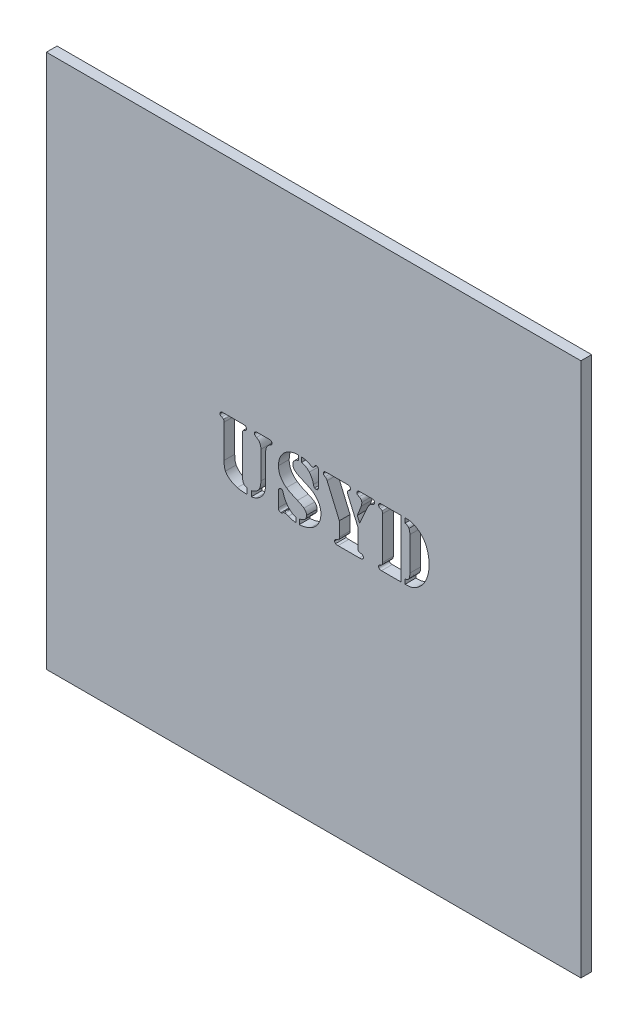
from build123d import *

# Parameters (mm, degrees)
SKETCH_2_W          = 100
SKETCH_2_H          = 100
EXTRUDE_2_DEPTH     = 2
CUT_EXTRUDE_1_DEPTH = 2


with BuildPart() as part:
    # 草图2 → 凸台-拉伸2 (new body)
    with BuildSketch(Plane.XY):
        with Locations((50, -50)):
            Rectangle(SKETCH_2_W, SKETCH_2_H)
    extrude(amount=EXTRUDE_2_DEPTH)

    # 草图5 → 切除-拉伸1 (cut)
    with BuildSketch(Plane.XY.offset(2)):
        with BuildLine():
            Line((33.234252528, -49.527946726), (33.234252528, -43.336225313))
            add(Edge.make_bspline(
                [(33.234252528, -43.336225313), (33.233680733, -43.292457438), (33.23261396, -43.21080157), (33.216775517, -43.098302202), (33.189981346, -43.00317877), (33.159591489, -42.951072897), (33.145297741, -42.926565106)],
                knots=[0, 0, 0, 0, 1.234380862, 2.302932019, 3.201790819, 4, 4, 4, 4], degree=3))
            add(Edge.make_bspline(
                [(33.145297741, -42.926565106), (33.132472916, -42.906095532), (33.11015473, -42.870473698), (33.067254502, -42.83595353), (33.019592543, -42.818169631), (32.962413365, -42.794281107), (32.878493497, -42.764053581), (32.814438943, -42.740862121), (32.777774012, -42.727587291)],
                knots=[0, 0, 0, 0, 1.009569614, 1.75688657, 2.256055053, 3.138468602, 4.362054748, 6, 6, 6, 6], degree=3))
            add(Edge.make_bspline(
                [(32.777774012, -42.727587291), (32.733041285, -42.70864447), (32.647816788, -42.67255473), (32.551225196, -42.572597106), (32.494199785, -42.444987847), (32.488297489, -42.351332059), (32.485159579, -42.301540676)],
                knots=[0, 0, 0, 0, 1.041483567, 1.98422766, 2.928330066, 4, 4, 4, 4], degree=3))
            add(Edge.make_bspline(
                [(32.485159579, -42.301540676), (32.486918159, -42.26858758), (32.49024579, -42.206232873), (32.516392092, -42.118297668), (32.562394983, -42.043374992), (32.626983719, -41.981481726), (32.708896069, -41.935524926), (32.803900692, -41.898792747), (32.915342853, -41.882296462), (32.99389192, -41.879374423), (33.035274714, -41.877834976)],
                knots=[0, 0, 0, 0, 1.002726072, 1.897384446, 2.761532256, 3.652394326, 4.589906903, 5.605228772, 6.738338646, 8, 8, 8, 8], degree=3))
            Line((33.035274714, -41.877834976), (33.227229782, -41.877834976))
            Line((33.227229782, -41.877834976), (36.687102844, -41.877834976))
            Line((36.687102844, -41.877834976), (36.893103405, -41.877834976))
            Line((36.893103405, -41.877834976), (37.178695092, -41.910607793))
            add(Edge.make_bspline(
                [(37.178695092, -41.910607793), (37.213912772, -41.927083493), (37.285596739, -41.960619023), (37.363670513, -42.054809237), (37.423026102, -42.169674779), (37.427061476, -42.257779477), (37.429173047, -42.303881592)],
                knots=[0, 0, 0, 0, 0.92965803, 1.892276139, 2.897101623, 4, 4, 4, 4], degree=3))
            add(Edge.make_bspline(
                [(37.429173047, -42.303881592), (37.42593834, -42.352875035), (37.419808759, -42.445714769), (37.363107795, -42.572595857), (37.266515735, -42.672555081), (37.181291305, -42.70864459), (37.136558613, -42.727587291)],
                knots=[0, 0, 0, 0, 1.059364441, 2.007434175, 2.954139888, 4, 4, 4, 4], degree=3))
            add(Edge.make_bspline(
                [(37.136558613, -42.727587291), (37.099736202, -42.740446599), (37.035141414, -42.763004715), (36.951824619, -42.797667653), (36.893099452, -42.820175732), (36.845109983, -42.837852199), (36.804253817, -42.873835352), (36.782007405, -42.908621326), (36.769034885, -42.928906022)],
                knots=[0, 0, 0, 0, 1.633395197, 2.865342401, 3.775729129, 4.273510971, 4.993234874, 6, 6, 6, 6], degree=3))
            add(Edge.make_bspline(
                [(36.769034885, -42.928906022), (36.754459391, -42.952541829), (36.723178576, -43.0032672), (36.701553068, -43.099080598), (36.680458762, -43.210428512), (36.680212109, -43.292369415), (36.680080097, -43.336225313)],
                knots=[0, 0, 0, 0, 0.783173522, 1.680787416, 2.758725557, 4, 4, 4, 4], degree=3))
            Line((36.680080097, -43.336225313), (36.680080097, -49.944629679))
            add(Edge.make_bspline(
                [(36.680080097, -49.944629679), (36.680288327, -50.048425234), (36.680668836, -50.23809623), (36.689045476, -50.497866626), (36.695314443, -50.706662286), (36.716898212, -50.91372167), (36.7583262, -51.131405397), (36.828382148, -51.283902088), (36.862671504, -51.358542622)],
                knots=[0, 0, 0, 0, 1.297880407, 2.371684116, 3.250791199, 3.908150793, 4.976130288, 6, 6, 6, 6], degree=3))
            add(Edge.make_bspline(
                [(36.862671504, -51.358542622), (36.89605467, -51.416331406), (36.957343591, -51.522427158), (37.065063652, -51.63408611), (37.174717174, -51.694520198), (37.282464773, -51.738908577), (37.416718584, -51.792021112), (37.517094975, -51.823540268), (37.571968891, -51.840771208)],
                knots=[0, 0, 0, 0, 1.349479507, 2.477540353, 3.078975584, 3.871221815, 4.836236359, 6, 6, 6, 6], degree=3))
            Line((37.571968891, -51.840771208), (37.571968891, -52.875455845))
            Line((37.571968891, -52.875455845), (37.398741146, -52.875455845))
            add(Edge.make_bspline(
                [(37.398741146, -52.875455845), (37.237145936, -52.873270663), (36.928424468, -52.869095956), (36.486075407, -52.836102183), (36.085439082, -52.784001229), (35.836175161, -52.723769666), (35.71796384, -52.695205354)],
                knots=[0, 0, 0, 0, 1.143959209, 2.185490323, 3.139484029, 4, 4, 4, 4], degree=3))
            add(Edge.make_bspline(
                [(35.71796384, -52.695205354), (35.589977579, -52.657730574), (35.338976223, -52.584236586), (34.982226695, -52.436302514), (34.646883153, -52.268824872), (34.340780769, -52.073552515), (34.067119359, -51.860098728), (33.833843817, -51.631931533), (33.638074572, -51.393347234), (33.544508803, -51.217448928), (33.498775976, -51.131473821)],
                knots=[0, 0, 0, 0, 1.145447734, 2.24640467, 3.314177613, 4.363509257, 5.361722521, 6.291268218, 7.164810629, 8, 8, 8, 8], degree=3))
            add(Edge.make_bspline(
                [(33.498775976, -51.131473821), (33.477690399, -51.083403511), (33.433793833, -50.983329345), (33.381675632, -50.82151821), (33.333589061, -50.644575608), (33.297261562, -50.451152047), (33.270054591, -50.242387641), (33.248163034, -50.018378729), (33.237498357, -49.778528136), (33.235354338, -49.613007576), (33.234252528, -49.527946726)],
                knots=[0, 0, 0, 0, 0.768921948, 1.600764009, 2.488515818, 3.455265764, 4.482371669, 5.573753861, 6.753154526, 8, 8, 8, 8], degree=3))
        make_face()
        with BuildLine():
            Line((38.328084587, -52.875455845), (38.328084587, -51.847793955))
            add(Edge.make_bspline(
                [(38.328084587, -51.847793955), (38.447939775, -51.825640571), (38.682688526, -51.782250882), (39.010884013, -51.642616608), (39.312941822, -51.456552625), (39.479712262, -51.288876244), (39.564087954, -51.204042201)],
                knots=[0, 0, 0, 0, 1.02613662, 2.009794435, 2.993077124, 4, 4, 4, 4], degree=3))
            add(Edge.make_bspline(
                [(39.564087954, -51.204042201), (39.609001425, -51.150346981), (39.699642575, -51.041983133), (39.814950706, -50.859873135), (39.909974774, -50.659547297), (39.990424824, -50.4436394), (40.050078771, -50.210369617), (40.095014639, -49.961694688), (40.120289336, -49.695451946), (40.123995229, -49.512392191), (40.125907666, -49.417923699)],
                knots=[0, 0, 0, 0, 0.876697886, 1.769288871, 2.692224349, 3.651442817, 4.652475985, 5.70565652, 6.815997718, 8, 8, 8, 8], degree=3))
            Line((40.125907666, -49.417923699), (40.125907666, -44.284296077))
            add(Edge.make_bspline(
                [(40.125907666, -44.284296077), (40.124302107, -44.195934305), (40.121200717, -44.025249658), (40.079379325, -43.780456211), (40.017604993, -43.555695754), (39.928325932, -43.351726421), (39.811389306, -43.170044973), (39.673340214, -43.005283287), (39.504060951, -42.866568303), (39.377855149, -42.791533752), (39.313609999, -42.753337361)],
                knots=[0, 0, 0, 0, 1.158086529, 2.237026091, 3.248207816, 4.210847961, 5.145307146, 6.074817308, 7.019984419, 8, 8, 8, 8], degree=3))
            add(Edge.make_bspline(
                [(39.313609999, -42.753337361), (39.276697898, -42.732682383), (39.209752524, -42.695221625), (39.12031253, -42.637709645), (39.051618993, -42.586060006), (38.982568726, -42.521431933), (38.935285522, -42.409428165), (38.93018764, -42.31444757), (38.927358946, -42.261745113)],
                knots=[0, 0, 0, 0, 1.137143506, 2.062372392, 2.855431385, 3.448813392, 4.584407656, 6, 6, 6, 6], degree=3))
            add(Edge.make_bspline(
                [(38.927358946, -42.261745113), (38.929004012, -42.229577456), (38.932126634, -42.168517624), (38.959744946, -42.082867933), (39.01192468, -42.015485447), (39.081509845, -41.960880361), (39.173509377, -41.922237109), (39.287272823, -41.895218535), (39.424758786, -41.87938073), (39.524248275, -41.878378047), (39.578133447, -41.877834976)],
                knots=[0, 0, 0, 0, 0.897096013, 1.702844927, 2.465039847, 3.240496688, 4.147058219, 5.22452456, 6.496756074, 8, 8, 8, 8], degree=3))
            Line((39.578133447, -41.877834976), (41.537479693, -41.877834976))
            add(Edge.make_bspline(
                [(41.537479693, -41.877834976), (41.574151725, -41.877690152), (41.641263741, -41.877425115), (41.731866732, -41.879031177), (41.802816061, -41.884517192), (41.871543644, -41.889120086), (41.944817706, -41.907195215), (41.994522488, -41.935872405), (42.01970828, -41.950403356)],
                knots=[0, 0, 0, 0, 1.333773652, 2.440885764, 3.294120428, 3.921014534, 4.946562232, 6, 6, 6, 6], degree=3))
            add(Edge.make_bspline(
                [(42.01970828, -41.950403356), (42.050570029, -41.97082826), (42.108806765, -42.009370461), (42.175292383, -42.088242267), (42.218033239, -42.178962616), (42.221580296, -42.244900473), (42.223367925, -42.278131521)],
                knots=[0, 0, 0, 0, 1.091391213, 2.059476941, 3.022024376, 4, 4, 4, 4], degree=3))
            add(Edge.make_bspline(
                [(42.223367925, -42.278131521), (42.222197578, -42.306383832), (42.219879066, -42.362352971), (42.196021129, -42.442474992), (42.15522246, -42.515492846), (42.116678763, -42.555141949), (42.09695849, -42.575427786)],
                knots=[0, 0, 0, 0, 1.016371757, 2.013479646, 2.983628243, 4, 4, 4, 4], degree=3))
            add(Edge.make_bspline(
                [(42.09695849, -42.575427786), (42.085365597, -42.584940563), (42.05251264, -42.611898704), (41.98436811, -42.656695183), (41.885333435, -42.7212385), (41.806943283, -42.767011297), (41.762207578, -42.793132924)],
                knots=[0, 0, 0, 0, 0.450033346, 1.275343907, 2.445092823, 4, 4, 4, 4], degree=3))
            add(Edge.make_bspline(
                [(41.762207578, -42.793132924), (41.706132848, -42.827072192), (41.593221295, -42.895411985), (41.448958391, -43.034954078), (41.319741239, -43.196070097), (41.21448749, -43.382474245), (41.129400669, -43.587652445), (41.069884142, -43.808017174), (41.030387862, -44.041770578), (41.026704323, -44.202195654), (41.024819206, -44.284296077)],
                knots=[0, 0, 0, 0, 0.899617234, 1.811460858, 2.744067812, 3.735198226, 4.746433817, 5.793921433, 6.870999549, 8, 8, 8, 8], degree=3))
            Line((41.024819206, -44.284296077), (41.024819206, -49.424946445))
            add(Edge.make_bspline(
                [(41.024819206, -49.424946445), (41.022914782, -49.532680065), (41.019196934, -49.742999379), (40.993231706, -50.051887131), (40.949701016, -50.346155547), (40.886107389, -50.62523949), (40.806374092, -50.889974649), (40.708746415, -51.140168174), (40.591531559, -51.375829394), (40.499341692, -51.522338735), (40.453635832, -51.594975084)],
                knots=[0, 0, 0, 0, 1.135464037, 2.216671254, 3.264679816, 4.268276654, 5.230935086, 6.176328675, 7.095860875, 8, 8, 8, 8], degree=3))
            add(Edge.make_bspline(
                [(40.453635832, -51.594975084), (40.379243541, -51.696519346), (40.229052125, -51.901528178), (39.946526568, -52.168743235), (39.622607414, -52.40830393), (39.379554461, -52.534568016), (39.255087112, -52.59922782)],
                knots=[0, 0, 0, 0, 0.953383016, 1.9247955, 2.937288351, 4, 4, 4, 4], degree=3))
            add(Edge.make_bspline(
                [(39.255087112, -52.59922782), (39.187698768, -52.630117229), (39.049826747, -52.693314884), (38.825968832, -52.767330062), (38.584472977, -52.830762232), (38.414962774, -52.860311243), (38.328084587, -52.875455845)],
                knots=[0, 0, 0, 0, 0.915823789, 1.873713905, 2.910225592, 4, 4, 4, 4], degree=3))
        make_face()
        with BuildLine():
            Line((47.167381394, -41.664811669), (47.167381394, -42.582450532))
            add(Edge.make_bspline(
                [(47.167381394, -42.582450532), (47.086226936, -42.605213118), (46.93065788, -42.648847861), (46.719236796, -42.746642464), (46.535475661, -42.858299713), (46.384136785, -42.990273813), (46.26259972, -43.139476539), (46.181970984, -43.309410109), (46.126384921, -43.492724161), (46.121272794, -43.621384712), (46.118651264, -43.687362633)],
                knots=[0, 0, 0, 0, 1.221315998, 2.341201987, 3.368653272, 4.331620241, 5.242373549, 6.138723041, 7.045525736, 8, 8, 8, 8], degree=3))
            add(Edge.make_bspline(
                [(46.118651264, -43.687362633), (46.121359933, -43.751563865), (46.126634255, -43.876576554), (46.167791807, -44.058548141), (46.235851141, -44.227604255), (46.331692836, -44.386253632), (46.460450982, -44.533903264), (46.620976214, -44.676715765), (46.816991712, -44.814178847), (46.962231024, -44.89800066), (47.038631043, -44.942093324)],
                knots=[0, 0, 0, 0, 0.936089583, 1.822754381, 2.706490469, 3.585151587, 4.513803219, 5.553860443, 6.713260834, 8, 8, 8, 8], degree=3))
            add(Edge.make_bspline(
                [(47.038631043, -44.942093324), (47.070494848, -44.959508973), (47.142785518, -44.999020542), (47.266798196, -45.05857023), (47.417542763, -45.129262235), (47.594581845, -45.209706962), (47.795706708, -45.305647812), (48.026039667, -45.404095061), (48.281438918, -45.517670652), (48.461077507, -45.596100972), (48.555544266, -45.637345218)],
                knots=[0, 0, 0, 0, 0.522083255, 1.184470872, 1.977560059, 2.916398476, 3.980628574, 5.181427924, 6.517794128, 8, 8, 8, 8], degree=3))
            add(Edge.make_bspline(
                [(48.555544266, -45.637345218), (48.669003582, -45.686588599), (48.883964696, -45.779885584), (49.183770736, -45.92271664), (49.443954774, -46.057018709), (49.737093932, -46.229685328), (50.070222037, -46.468281024), (50.300898861, -46.695989347), (50.418912979, -46.812484783)],
                knots=[0, 0, 0, 0, 1.002664352, 1.899657555, 2.691938798, 3.375452079, 4.657282928, 6, 6, 6, 6], degree=3))
            add(Edge.make_bspline(
                [(50.418912979, -46.812484783), (50.493889498, -46.894625391), (50.641938875, -47.056821049), (50.833489733, -47.321130878), (50.999609709, -47.594595916), (51.13043126, -47.882991873), (51.233656052, -48.180862799), (51.309539416, -48.490163181), (51.354943786, -48.811825604), (51.359827057, -49.030746152), (51.362301913, -49.141695674)],
                knots=[0, 0, 0, 0, 1.034400775, 2.042537998, 3.032752643, 4.007694519, 4.983852961, 5.96324819, 6.967768718, 8, 8, 8, 8], degree=3))
            add(Edge.make_bspline(
                [(51.362301913, -49.141695674), (51.35612218, -49.308401278), (51.343946857, -49.636845057), (51.243411261, -50.117879714), (51.085097548, -50.578194847), (50.85826057, -51.010788836), (50.578992727, -51.41068107), (50.246994532, -51.767561861), (49.868770667, -52.081287664), (49.584245673, -52.246502042), (49.440410313, -52.330022541)],
                knots=[0, 0, 0, 0, 1.021726653, 2.013008284, 3.001500974, 3.999129692, 4.999052287, 5.98466679, 6.981192572, 8, 8, 8, 8], degree=3))
            add(Edge.make_bspline(
                [(49.440410313, -52.330022541), (49.35895572, -52.370847893), (49.193657535, -52.453695972), (48.93446604, -52.5598658), (48.664259874, -52.654273974), (48.386560899, -52.732322965), (48.108491481, -52.795708077), (47.836297428, -52.839415617), (47.573825322, -52.869884888), (47.401553564, -52.873624653), (47.317199984, -52.875455845)],
                knots=[0, 0, 0, 0, 0.988584579, 2.006163536, 3.03732575, 4.093604654, 5.135285673, 6.130774793, 7.084726137, 8, 8, 8, 8], degree=3))
            Line((47.317199984, -52.875455845), (47.317199984, -51.978885221))
            add(Edge.make_bspline(
                [(47.317199984, -51.978885221), (47.428702629, -51.950731772), (47.638222768, -51.897829759), (47.922662558, -51.789413381), (48.161445779, -51.670745241), (48.350428453, -51.527513553), (48.494527651, -51.361177166), (48.594047181, -51.167805861), (48.657109407, -50.949670574), (48.662684989, -50.794833895), (48.665567293, -50.714790868)],
                knots=[0, 0, 0, 0, 1.35896739, 2.553580996, 3.593739597, 4.501887768, 5.339697937, 6.17353428, 7.055806124, 8, 8, 8, 8], degree=3))
            add(Edge.make_bspline(
                [(48.665567293, -50.714790868), (48.659693171, -50.628143834), (48.647996865, -50.455615877), (48.552827901, -50.207570071), (48.39878496, -49.97680831), (48.259000076, -49.848215529), (48.185679622, -49.780765596)],
                knots=[0, 0, 0, 0, 0.956506711, 1.904556217, 2.900890541, 4, 4, 4, 4], degree=3))
            add(Edge.make_bspline(
                [(48.185679622, -49.780765596), (48.156315712, -49.757744327), (48.093729192, -49.708676574), (47.986247982, -49.638022184), (47.860398216, -49.564640953), (47.718132578, -49.484735848), (47.557150754, -49.402264961), (47.377729361, -49.317108171), (47.181176456, -49.224609994), (47.042732047, -49.165439876), (46.970744495, -49.134672927)],
                knots=[0, 0, 0, 0, 0.648896759, 1.383064736, 2.23514521, 3.183146396, 4.221327961, 5.380997987, 6.638185931, 8, 8, 8, 8], degree=3))
            add(Edge.make_bspline(
                [(46.970744495, -49.134672927), (46.891807021, -49.100625986), (46.740700067, -49.035451242), (46.525173447, -48.937092993), (46.325640209, -48.853658586), (46.149404464, -48.768613962), (45.98853579, -48.70146277), (45.850857327, -48.633144827), (45.729363172, -48.579004109), (45.53373824, -48.482961379), (45.261655791, -48.332254063), (45.037435445, -48.176100734), (44.924784376, -48.097647375)],
                knots=[0, 0, 0, 0, 1.121856981, 2.147527434, 3.091543735, 3.943587412, 4.700435388, 5.36546554, 5.948667186, 6.435970719, 8.209387708, 10, 10, 10, 10], degree=3))
            add(Edge.make_bspline(
                [(44.924784376, -48.097647375), (44.805713741, -48.008019115), (44.572810219, -47.832705217), (44.264908152, -47.533986448), (44.003709719, -47.21312616), (43.791705413, -46.86789329), (43.623962091, -46.50199026), (43.506817019, -46.112924882), (43.434553286, -45.702469518), (43.426188392, -45.42072451), (43.421916645, -45.276844236)],
                knots=[0, 0, 0, 0, 1.072629812, 2.098076158, 3.081155049, 4.045090279, 5.008386299, 5.971993782, 6.964346906, 8, 8, 8, 8], degree=3))
            add(Edge.make_bspline(
                [(43.421916645, -45.276844236), (43.426239148, -45.129073913), (43.434751805, -44.838057796), (43.507566861, -44.410750478), (43.62460381, -44.000563309), (43.788296369, -43.611000469), (43.992636029, -43.246828436), (44.241944245, -42.92073248), (44.521662811, -42.624666063), (44.738807966, -42.463946301), (44.847534165, -42.383472717)],
                knots=[0, 0, 0, 0, 1.056681967, 2.081009744, 3.091782246, 4.102755181, 5.097879215, 6.070461086, 7.033865475, 8, 8, 8, 8], degree=3))
            add(Edge.make_bspline(
                [(44.847534165, -42.383472717), (44.927155535, -42.331510034), (45.087493759, -42.226869729), (45.343600124, -42.091579621), (45.613531645, -41.97403421), (45.898092202, -41.876412744), (46.194985669, -41.794156795), (46.506258949, -41.730977464), (46.83154947, -41.686044826), (47.054106923, -41.671973509), (47.167381394, -41.664811669)],
                knots=[0, 0, 0, 0, 0.927145534, 1.867047348, 2.821631238, 3.796636345, 4.799446147, 5.825081488, 6.893037554, 8, 8, 8, 8], degree=3))
        make_face()
        with BuildLine():
            Line((47.766655754, -42.582450532), (47.766655754, -41.704607232))
            add(Edge.make_bspline(
                [(47.766655754, -41.704607232), (47.842431976, -41.710818068), (47.988941893, -41.722826441), (48.199945843, -41.753437466), (48.395512058, -41.792785982), (48.583571384, -41.844802122), (48.783559367, -41.910871664), (49.008645931, -42.004329949), (49.271576162, -42.118335287), (49.456333241, -42.20720658), (49.555115171, -42.254722367)],
                knots=[0, 0, 0, 0, 0.967485975, 1.870590603, 2.71201151, 3.504661189, 4.352621131, 5.390918259, 6.60503244, 8, 8, 8, 8], degree=3))
            add(Edge.make_bspline(
                [(49.555115171, -42.254722367), (49.601974012, -42.275436874), (49.684519482, -42.311927081), (49.773951851, -42.322653449), (49.812615873, -42.327290746)],
                knots=[0, 0, 0, 0, 1.13534614, 2, 2, 2, 2], degree=3))
            add(Edge.make_bspline(
                [(49.812615873, -42.327290746), (49.83547469, -42.32620674), (49.88017464, -42.324086989), (49.941714353, -42.299889673), (49.994605055, -42.260741292), (50.018102411, -42.224439852), (50.030321011, -42.205563142)],
                knots=[0, 0, 0, 0, 1.041120632, 2.035890107, 2.978664937, 4, 4, 4, 4], degree=3))
            Line((50.030321011, -42.205563142), (50.203548756, -41.934016948))
            add(Edge.make_bspline(
                [(50.203548756, -41.934016948), (50.223901267, -41.90229764), (50.261680908, -41.843418219), (50.337636068, -41.778408979), (50.419082485, -41.733529858), (50.478450436, -41.729843171), (50.507867767, -41.728016386)],
                knots=[0, 0, 0, 0, 1.167643081, 2.167454281, 3.0919578, 4, 4, 4, 4], degree=3))
            add(Edge.make_bspline(
                [(50.507867767, -41.728016386), (50.540907697, -41.729396081), (50.603921851, -41.73202745), (50.690763811, -41.763290275), (50.76256002, -41.815483081), (50.820067603, -41.888168343), (50.860832971, -41.983701815), (50.894561376, -42.0981194), (50.907971052, -42.237282854), (50.911133108, -42.336658834), (50.912846143, -42.390495464)],
                knots=[0, 0, 0, 0, 0.897447072, 1.711621872, 2.473249793, 3.290475505, 4.204161629, 5.288175448, 6.530877421, 8, 8, 8, 8], degree=3))
            Line((50.912846143, -42.390495464), (50.912846143, -45.031048112))
            add(Edge.make_bspline(
                [(50.912846143, -45.031048112), (50.912084225, -45.072589995), (50.910615512, -45.152668314), (50.882927594, -45.265925231), (50.844072199, -45.368906769), (50.787511981, -45.457126626), (50.720321345, -45.532267882), (50.638557277, -45.583086357), (50.549125996, -45.620001728), (50.484855077, -45.622177066), (50.451685795, -45.623299725)],
                knots=[0, 0, 0, 0, 1.18556103, 2.285349829, 3.31800963, 4.321767828, 5.269816893, 6.174247696, 7.05775591, 8, 8, 8, 8], degree=3))
            add(Edge.make_bspline(
                [(50.451685795, -45.623299725), (50.400273084, -45.618796439), (50.294948146, -45.609570931), (50.208171291, -45.548975337), (50.163753193, -45.517958529)],
                knots=[0, 0, 0, 0, 0.976268549, 2, 2, 2, 2], degree=3))
            add(Edge.make_bspline(
                [(50.163753193, -45.517958529), (50.141800127, -45.494488664), (50.096859678, -45.446443152), (50.040170787, -45.350735133), (49.999299086, -45.213247799), (49.979090196, -45.106186955), (49.967116294, -45.042752689)],
                knots=[0, 0, 0, 0, 0.734618928, 1.503849384, 2.521014053, 4, 4, 4, 4], degree=3))
            add(Edge.make_bspline(
                [(49.967116294, -45.042752689), (49.932824762, -44.905633056), (49.861742808, -44.621401611), (49.675581417, -44.213888437), (49.45870479, -43.813882374), (49.272115756, -43.575105261), (49.180568696, -43.457952917)],
                knots=[0, 0, 0, 0, 0.948439242, 1.965993117, 3.002045587, 4, 4, 4, 4], degree=3))
            add(Edge.make_bspline(
                [(49.180568696, -43.457952917), (49.084030565, -43.3528478), (48.893615889, -43.145535345), (48.550156951, -42.899206719), (48.176194615, -42.701121127), (47.904220278, -42.622312107), (47.766655754, -42.582450532)],
                knots=[0, 0, 0, 0, 1.010958313, 1.994044201, 2.985388257, 4, 4, 4, 4], degree=3))
        make_face()
        with BuildLine():
            Line((46.717925624, -51.978885221), (46.717925624, -52.875455845))
            add(Edge.make_bspline(
                [(46.717925624, -52.875455845), (46.60607467, -52.871062462), (46.376152304, -52.862031363), (46.024418907, -52.79625597), (45.655892693, -52.696519995), (45.410137267, -52.601557937), (45.282944442, -52.55240951)],
                knots=[0, 0, 0, 0, 0.90692939, 1.864296574, 2.894648409, 4, 4, 4, 4], degree=3))
            add(Edge.make_bspline(
                [(45.282944442, -52.55240951), (45.237671745, -52.534494092), (45.154941205, -52.501755766), (45.043029928, -52.456960392), (44.953623782, -52.422959763), (44.865460685, -52.396139388), (44.772473741, -52.371020951), (44.700234513, -52.367067629), (44.664942759, -52.365136273)],
                knots=[0, 0, 0, 0, 1.349771181, 2.466548425, 3.342620573, 3.999496596, 5.022674002, 6, 6, 6, 6], degree=3))
            add(Edge.make_bspline(
                [(44.664942759, -52.365136273), (44.618699678, -52.365286741), (44.538471406, -52.365547791), (44.422128442, -52.395296241), (44.304801369, -52.461195367), (44.224697022, -52.520692601), (44.175691426, -52.557091341)],
                knots=[0, 0, 0, 0, 1.025725037, 1.779555911, 2.641594495, 4, 4, 4, 4], degree=3))
            add(Edge.make_bspline(
                [(44.175691426, -52.557091341), (44.128017322, -52.587907977), (44.033703586, -52.648872562), (43.921953009, -52.659512056), (43.866690584, -52.664773453)],
                knots=[0, 0, 0, 0, 1.010968418, 2, 2, 2, 2], degree=3))
            add(Edge.make_bspline(
                [(43.866690584, -52.664773453), (43.831374998, -52.663091595), (43.765134954, -52.659937), (43.672216123, -52.633346683), (43.59253786, -52.589196842), (43.530754349, -52.522099431), (43.480675579, -52.441336577), (43.445881606, -52.342464002), (43.425226933, -52.226325567), (43.423068923, -52.142846091), (43.421916645, -52.09827191)],
                knots=[0, 0, 0, 0, 1.030217647, 1.932338358, 2.800681709, 3.655444571, 4.566741571, 5.56230499, 6.698383569, 8, 8, 8, 8], degree=3))
            Line((43.421916645, -52.09827191), (43.421916645, -49.235332292))
            add(Edge.make_bspline(
                [(43.421916645, -49.235332292), (43.422788755, -49.204661324), (43.424521499, -49.143722969), (43.452674942, -49.058194889), (43.489504872, -48.977024879), (43.546517942, -48.908118817), (43.614120228, -48.850165031), (43.689745836, -48.803111965), (43.776315858, -48.778186367), (43.836131438, -48.772430649), (43.866690584, -48.769490114)],
                knots=[0, 0, 0, 0, 1.025048767, 2.036609463, 2.997690381, 4.004487562, 5.007868388, 5.983135769, 6.96960544, 8, 8, 8, 8], degree=3))
            add(Edge.make_bspline(
                [(43.866690584, -48.769490114), (43.919495723, -48.771569838), (44.019360591, -48.775503003), (44.128002719, -48.847588871), (44.1923845, -48.929022402), (44.235665703, -49.012120153), (44.275350837, -49.114415775), (44.297273017, -49.189864655), (44.309123607, -49.230650461)],
                knots=[0, 0, 0, 0, 1.332817487, 2.520619119, 3.18935181, 3.986203612, 4.911391244, 6, 6, 6, 6], degree=3))
            add(Edge.make_bspline(
                [(44.309123607, -49.230650461), (44.341172582, -49.339604167), (44.405087587, -49.556889636), (44.527461819, -49.872943973), (44.671609544, -50.177772628), (44.830695736, -50.471872303), (45.011222145, -50.747320778), (45.205939744, -51.003097708), (45.413037446, -51.2391825), (45.565659982, -51.37858689), (45.641104509, -51.44749741)],
                knots=[0, 0, 0, 0, 1.039224005, 2.072515798, 3.098176232, 4.124234497, 5.130614068, 6.109159237, 7.065317673, 8, 8, 8, 8], degree=3))
            add(Edge.make_bspline(
                [(45.641104509, -51.44749741), (45.719682117, -51.513206443), (45.875914334, -51.64385267), (46.140214093, -51.794158071), (46.421002252, -51.910628112), (46.617979202, -51.955909415), (46.717925624, -51.978885221)],
                knots=[0, 0, 0, 0, 1.009633933, 2.007408369, 2.988955799, 4, 4, 4, 4], degree=3))
        make_face()
        with BuildLine():
            Line((58.25395705, -47.744169139), (58.25395705, -51.171269384))
            add(Edge.make_bspline(
                [(58.25395705, -51.171269384), (58.254365189, -51.219135904), (58.255121984, -51.307892838), (58.284198557, -51.428725476), (58.316481674, -51.533907716), (58.359919388, -51.586571485), (58.380366486, -51.611361492)],
                knots=[0, 0, 0, 0, 1.221894812, 2.265709648, 3.183630964, 4, 4, 4, 4], degree=3))
            add(Edge.make_bspline(
                [(58.380366486, -51.611361492), (58.401119447, -51.633656105), (58.437887262, -51.673155249), (58.499238212, -51.709575022), (58.56489595, -51.727125499), (58.647054075, -51.743780255), (58.760516202, -51.777044754), (58.848408651, -51.796875204), (58.897708804, -51.807998392)],
                knots=[0, 0, 0, 0, 0.967781164, 1.714608312, 2.234126727, 3.127399629, 4.388716669, 6, 6, 6, 6], degree=3))
            add(Edge.make_bspline(
                [(58.897708804, -51.807998392), (58.958652259, -51.823534372), (59.070785123, -51.852119788), (59.206412694, -51.950029014), (59.290164237, -52.085369265), (59.298386483, -52.18759694), (59.30268718, -52.241067753)],
                knots=[0, 0, 0, 0, 1.155259645, 2.125619132, 3.019593567, 4, 4, 4, 4], degree=3))
            add(Edge.make_bspline(
                [(59.30268718, -52.241067753), (59.300351388, -52.277481993), (59.295852823, -52.347613184), (59.249487543, -52.445091605), (59.174179182, -52.526877414), (59.1081111, -52.565054106), (59.073277464, -52.585182327)],
                knots=[0, 0, 0, 0, 0.994063561, 1.914494494, 2.900441221, 4, 4, 4, 4], degree=3))
            add(Edge.make_bspline(
                [(59.073277464, -52.585182327), (59.045569999, -52.598086836), (58.98233304, -52.627538897), (58.863801233, -52.645860487), (58.717274312, -52.663935661), (58.608325304, -52.664477806), (58.548912399, -52.664773453)],
                knots=[0, 0, 0, 0, 0.682940478, 1.558680289, 2.668680889, 4, 4, 4, 4], degree=3))
            Line((58.548912399, -52.664773453), (58.260979797, -52.664773453))
            Line((58.260979797, -52.664773453), (54.801106735, -52.664773453))
            Line((54.801106735, -52.664773453), (54.559992442, -52.664773453))
            add(Edge.make_bspline(
                [(54.559992442, -52.664773453), (54.509229067, -52.663143507), (54.415211621, -52.66012473), (54.286019546, -52.645855073), (54.180755201, -52.617231695), (54.124148638, -52.585381442), (54.098832095, -52.571136834)],
                knots=[0, 0, 0, 0, 1.278909849, 2.36863365, 3.270392795, 4, 4, 4, 4], degree=3))
            add(Edge.make_bspline(
                [(54.098832095, -52.571136834), (54.070538868, -52.549617679), (54.01609456, -52.508208634), (53.952233144, -52.429373147), (53.915968739, -52.337572511), (53.911476416, -52.273353348), (53.909217942, -52.241067753)],
                knots=[0, 0, 0, 0, 1.071870055, 2.062586414, 3.025983099, 4, 4, 4, 4], degree=3))
            add(Edge.make_bspline(
                [(53.909217942, -52.241067753), (53.912001767, -52.187689552), (53.917273477, -52.086607628), (53.99237401, -51.954826145), (54.107049006, -51.852582465), (54.206821553, -51.823566907), (54.260355262, -51.807998392)],
                knots=[0, 0, 0, 0, 1.041821617, 1.972890251, 2.912339053, 4, 4, 4, 4], degree=3))
            add(Edge.make_bspline(
                [(54.260355262, -51.807998392), (54.303444107, -51.796898601), (54.379763623, -51.777238508), (54.476719057, -51.744333312), (54.546370085, -51.726876572), (54.602195, -51.709268077), (54.654294527, -51.672913629), (54.682258561, -51.633626473), (54.698106454, -51.611361492)],
                knots=[0, 0, 0, 0, 1.624637859, 2.877579422, 3.734891967, 4.248647568, 5.007466236, 6, 6, 6, 6], degree=3))
            add(Edge.make_bspline(
                [(54.698106454, -51.611361492), (54.716014513, -51.58636657), (54.754626343, -51.532474649), (54.782695099, -51.428491029), (54.805523126, -51.307320884), (54.807214316, -51.21904096), (54.808129481, -51.171269384)],
                knots=[0, 0, 0, 0, 0.793417505, 1.710699182, 2.761173524, 4, 4, 4, 4], degree=3))
            Line((54.808129481, -51.171269384), (54.808129481, -48.514330328))
            Line((54.808129481, -48.514330328), (52.516373238, -43.162997568))
            add(Edge.make_bspline(
                [(52.516373238, -43.162997568), (52.494486616, -43.115307001), (52.452232496, -43.023236012), (52.365441368, -42.902712248), (52.268438362, -42.798699056), (52.18986173, -42.749472908), (52.151190425, -42.725246376)],
                knots=[0, 0, 0, 0, 1.082554638, 2.089970468, 3.059983455, 4, 4, 4, 4], degree=3))
            add(Edge.make_bspline(
                [(52.151190425, -42.725246376), (52.118282808, -42.704405559), (52.057946236, -42.666193633), (51.977027651, -42.610618603), (51.917251213, -42.559972961), (51.859045734, -42.502654745), (51.819841211, -42.410100882), (51.814614174, -42.332334284), (51.811757682, -42.289836099)],
                knots=[0, 0, 0, 0, 1.198294031, 2.197088665, 3.0144823, 3.60868209, 4.693183511, 6, 6, 6, 6], degree=3))
            add(Edge.make_bspline(
                [(51.811757682, -42.289836099), (51.814262912, -42.257655333), (51.819089685, -42.195653329), (51.849145272, -42.107291091), (51.90667544, -42.035996535), (51.981405197, -41.974576738), (52.07990065, -41.932640336), (52.196795288, -41.898825093), (52.334892548, -41.882142758), (52.433634883, -41.879326711), (52.485941337, -41.877834976)],
                knots=[0, 0, 0, 0, 0.869639428, 1.675515981, 2.471429392, 3.30992598, 4.261357592, 5.334322907, 6.587919572, 8, 8, 8, 8], degree=3))
            Line((52.485941337, -41.877834976), (56.329724536, -41.877834976))
            add(Edge.make_bspline(
                [(56.329724536, -41.877834976), (56.373519236, -41.878434696), (56.454344891, -41.879541513), (56.563566405, -41.894489772), (56.654105826, -41.911669255), (56.701579097, -41.938360611), (56.722998334, -41.950403356)],
                knots=[0, 0, 0, 0, 1.297115613, 2.39390196, 3.275352329, 4, 4, 4, 4], degree=3))
            add(Edge.make_bspline(
                [(56.722998334, -41.950403356), (56.750520483, -41.971931609), (56.803540197, -42.013404453), (56.865264854, -42.092404261), (56.89856729, -42.185174121), (56.903215247, -42.2497987), (56.905589741, -42.282813352)],
                knots=[0, 0, 0, 0, 1.058439991, 2.039019055, 2.998196884, 4, 4, 4, 4], degree=3))
            add(Edge.make_bspline(
                [(56.905589741, -42.282813352), (56.90337605, -42.323147847), (56.899056658, -42.401849248), (56.850127278, -42.511035184), (56.777015058, -42.608067709), (56.709009066, -42.654444079), (56.673839109, -42.678428066)],
                knots=[0, 0, 0, 0, 1.001945491, 1.955014285, 2.942415868, 4, 4, 4, 4], degree=3))
            Line((56.673839109, -42.678428066), (56.442088478, -42.823564825))
            add(Edge.make_bspline(
                [(56.442088478, -42.823564825), (56.421649964, -42.838982216), (56.381927151, -42.868946338), (56.338062379, -42.930509126), (56.311410878, -43.003313468), (56.308068193, -43.055855069), (56.306315381, -43.083406442)],
                knots=[0, 0, 0, 0, 0.999710664, 1.94296504, 2.921347354, 4, 4, 4, 4], degree=3))
            add(Edge.make_bspline(
                [(56.306315381, -43.083406442), (56.310852249, -43.149689063), (56.320087016, -43.284606916), (56.369919469, -43.41036423), (56.395270169, -43.474339326)],
                knots=[0, 0, 0, 0, 0.982562641, 2, 2, 2, 2], degree=3))
            Line((56.395270169, -43.474339326), (58.25395705, -47.744169139))
        make_face()
        with BuildLine():
            Line((58.607435286, -46.997417105), (58.165002263, -45.965073384))
            Line((58.165002263, -45.965073384), (58.911754297, -44.092341009))
            add(Edge.make_bspline(
                [(58.911754297, -44.092341009), (58.926114022, -44.048920878), (58.956692105, -43.956460587), (58.98175078, -43.802760053), (59.002356808, -43.628617848), (59.002809795, -43.504853842), (59.00305, -43.439225594)],
                knots=[0, 0, 0, 0, 0.82696258, 1.760961971, 2.812706963, 4, 4, 4, 4], degree=3))
            add(Edge.make_bspline(
                [(59.00305, -43.439225594), (59.002018417, -43.401628642), (59.000018989, -43.328757772), (58.975519489, -43.224553297), (58.937515702, -43.129144724), (58.885419527, -43.040761841), (58.816851877, -42.961367338), (58.733575991, -42.889778826), (58.633927674, -42.829394678), (58.560991371, -42.796268572), (58.523162329, -42.779087432)],
                knots=[0, 0, 0, 0, 1.032187492, 2.000598378, 2.925210881, 3.849075819, 4.808166802, 5.797517451, 6.857663475, 8, 8, 8, 8], degree=3))
            add(Edge.make_bspline(
                [(58.523162329, -42.779087432), (58.483044683, -42.761807652), (58.409561952, -42.730156607), (58.313455412, -42.677661396), (58.237404692, -42.632481695), (58.16471224, -42.573247614), (58.11044014, -42.467352321), (58.106379677, -42.375595819), (58.10413846, -42.324949831)],
                knots=[0, 0, 0, 0, 1.173153587, 2.148843138, 2.940136821, 3.549689239, 4.647524616, 6, 6, 6, 6], degree=3))
            add(Edge.make_bspline(
                [(58.10413846, -42.324949831), (58.105770913, -42.291175165), (58.108909718, -42.2262348), (58.137490722, -42.135355678), (58.185556915, -42.056641911), (58.230927807, -42.017227522), (58.25395705, -41.997221665)],
                knots=[0, 0, 0, 0, 1.081882069, 2.080192833, 3.025549083, 4, 4, 4, 4], degree=3))
            add(Edge.make_bspline(
                [(58.25395705, -41.997221665), (58.288990858, -41.975211398), (58.358635564, -41.93145656), (58.462991785, -41.900956624), (58.56132139, -41.891347588), (58.658649379, -41.87984093), (58.779145702, -41.880770149), (58.86651267, -41.878869904), (58.914095212, -41.877834976)],
                knots=[0, 0, 0, 0, 1.08761051, 2.162092009, 2.825884535, 3.694296283, 4.744248016, 6, 6, 6, 6], degree=3))
            Line((58.914095212, -41.877834976), (60.866418713, -41.877834976))
            add(Edge.make_bspline(
                [(60.866418713, -41.877834976), (60.907849236, -41.879092392), (60.986627787, -41.88148332), (61.096877636, -41.901481443), (61.190009158, -41.937249237), (61.268890472, -41.983968923), (61.328423688, -42.049612974), (61.371519178, -42.128123525), (61.394555438, -42.221495299), (61.398198848, -42.28737481), (61.400147439, -42.322608915)],
                knots=[0, 0, 0, 0, 1.25156662, 2.379805907, 3.364963246, 4.25465276, 5.122199354, 6.008445906, 6.934864206, 8, 8, 8, 8], degree=3))
            add(Edge.make_bspline(
                [(61.400147439, -42.322608915), (61.39741392, -42.370126053), (61.392337349, -42.458372784), (61.328988829, -42.582388745), (61.202186857, -42.675302565), (61.099964391, -42.724379037), (61.039646457, -42.753337361)],
                knots=[0, 0, 0, 0, 0.938592744, 1.743113009, 2.668289224, 4, 4, 4, 4], degree=3))
            add(Edge.make_bspline(
                [(61.039646457, -42.753337361), (60.979979461, -42.781484341), (60.867517284, -42.834536628), (60.71448534, -42.920184221), (60.589339093, -43.007982314), (60.520908945, -43.07253438), (60.489531322, -43.102133766)],
                knots=[0, 0, 0, 0, 1.208567348, 2.277944674, 3.210377236, 4, 4, 4, 4], degree=3))
            add(Edge.make_bspline(
                [(60.489531322, -43.102133766), (60.414110318, -43.190197684), (60.261350399, -43.368564933), (60.153301281, -43.577102777), (60.098598439, -43.682680802)],
                knots=[0, 0, 0, 0, 0.987444929, 2, 2, 2, 2], degree=3))
            Line((60.098598439, -43.682680802), (59.918347948, -44.087659178))
            Line((59.918347948, -44.087659178), (58.607435286, -46.997417105))
        make_face()
        with BuildLine():
            Line((66.344160908, -41.877834976), (66.344160908, -52.664773453))
            Line((66.344160908, -52.664773453), (62.891310592, -52.664773453))
            Line((62.891310592, -52.664773453), (62.685310031, -52.664773453))
            add(Edge.make_bspline(
                [(62.685310031, -52.664773453), (62.644647208, -52.663427969), (62.568302989, -52.660901831), (62.460192212, -52.642192483), (62.36577527, -52.610729312), (62.287275642, -52.562997911), (62.222951928, -52.503865103), (62.182116892, -52.429378398), (62.153910141, -52.346055658), (62.15085681, -52.286592703), (62.149240389, -52.255113246)],
                knots=[0, 0, 0, 0, 1.275809178, 2.395324508, 3.433364274, 4.378530456, 5.262016052, 6.140052186, 7.015350866, 8, 8, 8, 8], degree=3))
            add(Edge.make_bspline(
                [(62.149240389, -52.255113246), (62.15242517, -52.205367292), (62.158415627, -52.111796953), (62.214611266, -51.984125721), (62.312818683, -51.886607646), (62.39726217, -51.850483743), (62.441854823, -51.831407546)],
                knots=[0, 0, 0, 0, 1.074896783, 2.021841926, 2.955380476, 4, 4, 4, 4], degree=3))
            add(Edge.make_bspline(
                [(62.441854823, -51.831407546), (62.478581572, -51.818295467), (62.542744125, -51.795388335), (62.625805687, -51.763681978), (62.684077167, -51.743446567), (62.731289631, -51.725261767), (62.774254247, -51.690911382), (62.796560553, -51.655258223), (62.809378551, -51.634770647)],
                knots=[0, 0, 0, 0, 1.641128884, 2.867093284, 3.73955991, 4.239698614, 4.988468111, 6, 6, 6, 6], degree=3))
            add(Edge.make_bspline(
                [(62.809378551, -51.634770647), (62.823724393, -51.611071097), (62.854627101, -51.56001935), (62.880175438, -51.466791195), (62.896991351, -51.356852999), (62.89786171, -51.277482982), (62.898333339, -51.234474102)],
                knots=[0, 0, 0, 0, 0.795728394, 1.714096871, 2.761318972, 4, 4, 4, 4], degree=3))
            Line((62.898333339, -51.234474102), (62.898333339, -43.336225313))
            add(Edge.make_bspline(
                [(62.898333339, -43.336225313), (62.897761544, -43.292457438), (62.89669477, -43.21080157), (62.880856327, -43.098302202), (62.854062157, -43.00317877), (62.8236723, -42.951072897), (62.809378551, -42.926565106)],
                knots=[0, 0, 0, 0, 1.234380862, 2.302932019, 3.201790819, 4, 4, 4, 4], degree=3))
            add(Edge.make_bspline(
                [(62.809378551, -42.926565106), (62.796553726, -42.906095532), (62.774235541, -42.870473698), (62.731335313, -42.83595353), (62.683673354, -42.818169631), (62.626494176, -42.794281107), (62.542574308, -42.764053581), (62.478519754, -42.740862121), (62.441854823, -42.727587291)],
                knots=[0, 0, 0, 0, 1.009569614, 1.75688657, 2.256055053, 3.138468602, 4.362054748, 6, 6, 6, 6], degree=3))
            add(Edge.make_bspline(
                [(62.441854823, -42.727587291), (62.3970078, -42.708761243), (62.311042131, -42.672674258), (62.215262856, -42.56991257), (62.15828953, -42.440246253), (62.152380741, -42.345090495), (62.149240389, -42.29451793)],
                knots=[0, 0, 0, 0, 1.03007389, 1.974512116, 2.923511095, 4, 4, 4, 4], degree=3))
            add(Edge.make_bspline(
                [(62.149240389, -42.29451793), (62.150894636, -42.262281448), (62.154022152, -42.201335226), (62.181559885, -42.116157598), (62.223018359, -42.041142879), (62.287201179, -41.981782594), (62.366259645, -41.934772904), (62.459634348, -41.89965342), (62.568391242, -41.881948302), (62.644677879, -41.879264458), (62.685310031, -41.877834976)],
                knots=[0, 0, 0, 0, 1.002003185, 1.894384998, 2.766311233, 3.643649008, 4.582238159, 5.621343591, 6.733068665, 8, 8, 8, 8], degree=3))
            Line((62.685310031, -41.877834976), (62.891310592, -41.877834976))
            Line((62.891310592, -41.877834976), (66.344160908, -41.877834976))
        make_face()
        with BuildLine():
            Line((67.992165397, -50.408130942), (67.992165397, -44.16959122))
            add(Edge.make_bspline(
                [(67.992165397, -44.16959122), (67.991139801, -44.07813422), (67.989194878, -43.904696726), (67.954178464, -43.659841586), (67.90723631, -43.441991908), (67.852055161, -43.312967199), (67.825960399, -43.251952356)],
                knots=[0, 0, 0, 0, 1.16641187, 2.211963568, 3.154450632, 4, 4, 4, 4], degree=3))
            add(Edge.make_bspline(
                [(67.825960399, -43.251952356), (67.791347716, -43.185597378), (67.727260332, -43.0627373), (67.601542004, -42.940562115), (67.482345335, -42.876407915), (67.375578625, -42.827236145), (67.244581457, -42.790914292), (67.150258765, -42.767882802), (67.100276604, -42.755678277)],
                knots=[0, 0, 0, 0, 1.457833341, 2.699262692, 3.348540754, 4.10007247, 4.993216973, 6, 6, 6, 6], degree=3))
            Line((67.100276604, -42.755678277), (67.100276604, -41.877834976))
            add(Edge.make_bspline(
                [(67.100276604, -41.877834976), (67.229131875, -41.87803028), (67.46608097, -41.87838942), (67.701965713, -41.900514535), (67.809573991, -41.910607793)],
                knots=[0, 0, 0, 0, 1.087619859, 2, 2, 2, 2], degree=3))
            add(Edge.make_bspline(
                [(67.809573991, -41.910607793), (67.892480656, -41.921907395), (68.059440348, -41.94466284), (68.307224249, -42.000628238), (68.552122574, -42.079806076), (68.796186584, -42.174895122), (69.037153208, -42.293121857), (69.277250978, -42.429731551), (69.515505757, -42.585435108), (69.668232008, -42.703141768), (69.745511083, -42.762701023)],
                knots=[0, 0, 0, 0, 0.936606549, 1.886163682, 2.839451583, 3.816154009, 4.816486011, 5.841653465, 6.907882429, 8, 8, 8, 8], degree=3))
            add(Edge.make_bspline(
                [(69.745511083, -42.762701023), (69.821201678, -42.824209175), (69.971874314, -42.946649688), (70.183262053, -43.145999217), (70.377896296, -43.360384541), (70.558871781, -43.587201681), (70.722798372, -43.829726036), (70.872604589, -44.085526681), (71.009273112, -44.353935771), (71.085808103, -44.541217988), (71.124310293, -44.635433398)],
                knots=[0, 0, 0, 0, 0.993855288, 1.978406915, 2.957966916, 3.942936045, 4.933380559, 5.938657845, 6.963007808, 8, 8, 8, 8], degree=3))
            add(Edge.make_bspline(
                [(71.124310293, -44.635433398), (71.196564589, -44.834654558), (71.34259128, -45.237282616), (71.483246139, -45.874013772), (71.573299329, -46.53987886), (71.582909088, -46.994764537), (71.587811556, -47.226826821)],
                knots=[0, 0, 0, 0, 0.959594525, 1.939350611, 2.948749043, 4, 4, 4, 4], degree=3))
            add(Edge.make_bspline(
                [(71.587811556, -47.226826821), (71.586147095, -47.359540404), (71.582863308, -47.621368701), (71.552822502, -48.007880103), (71.510805861, -48.38346416), (71.442881274, -48.746946258), (71.363378945, -49.101179888), (71.258552861, -49.442638132), (71.140223449, -49.773982638), (71.001486598, -50.091662947), (70.848240944, -50.397096886), (70.673829874, -50.68428634), (70.486829037, -50.957389005), (70.282487785, -51.213074798), (70.062824522, -51.451845875), (69.826226859, -51.673561502), (69.57524855, -51.879868797), (69.395352894, -52.002068016), (69.305418975, -52.063158178)],
                knots=[0, 0, 0, 0, 1.141236443, 2.251525319, 3.332877678, 4.389965704, 5.430238544, 6.453617968, 7.459909911, 8.45483579, 9.433305294, 10.396674662, 11.342372521, 12.278351998, 13.209264917, 14.130352366, 15.065320729, 16, 16, 16, 16], degree=3))
            add(Edge.make_bspline(
                [(69.305418975, -52.063158178), (69.218944696, -52.118597581), (69.051915373, -52.225681514), (68.795507732, -52.354653849), (68.551418406, -52.463356925), (68.307355207, -52.542467636), (68.050561775, -52.601111511), (67.764982102, -52.634697082), (67.444945395, -52.662969678), (67.218962555, -52.664152327), (67.100276604, -52.664773453)],
                knots=[0, 0, 0, 0, 1.058876899, 2.045272807, 2.957407753, 3.812684457, 4.68750987, 5.669956757, 6.776263732, 8, 8, 8, 8], degree=3))
            Line((67.100276604, -52.664773453), (67.100276604, -51.815021138))
            add(Edge.make_bspline(
                [(67.100276604, -51.815021138), (67.151863962, -51.80131708), (67.24614213, -51.776272311), (67.3747868, -51.737066593), (67.476433705, -51.696896785), (67.583199576, -51.651702913), (67.692904508, -51.568915956), (67.754146222, -51.481497346), (67.786164836, -51.435792832)],
                knots=[0, 0, 0, 0, 1.19092102, 2.176460557, 2.997615368, 3.628656571, 4.760205639, 6, 6, 6, 6], degree=3))
            add(Edge.make_bspline(
                [(67.786164836, -51.435792832), (67.822659072, -51.3755038), (67.896384426, -51.253708396), (67.945020581, -51.075253034), (67.968687711, -50.915045432), (67.981872795, -50.768059665), (67.991793925, -50.596319928), (67.992035977, -50.473695401), (67.992165397, -50.408130942)],
                knots=[0, 0, 0, 0, 1.186817753, 2.397599372, 3.091812491, 3.926859709, 4.891540494, 6, 6, 6, 6], degree=3))
        make_face()
    extrude(amount=-CUT_EXTRUDE_1_DEPTH, mode=Mode.SUBTRACT)


solid = part.part
